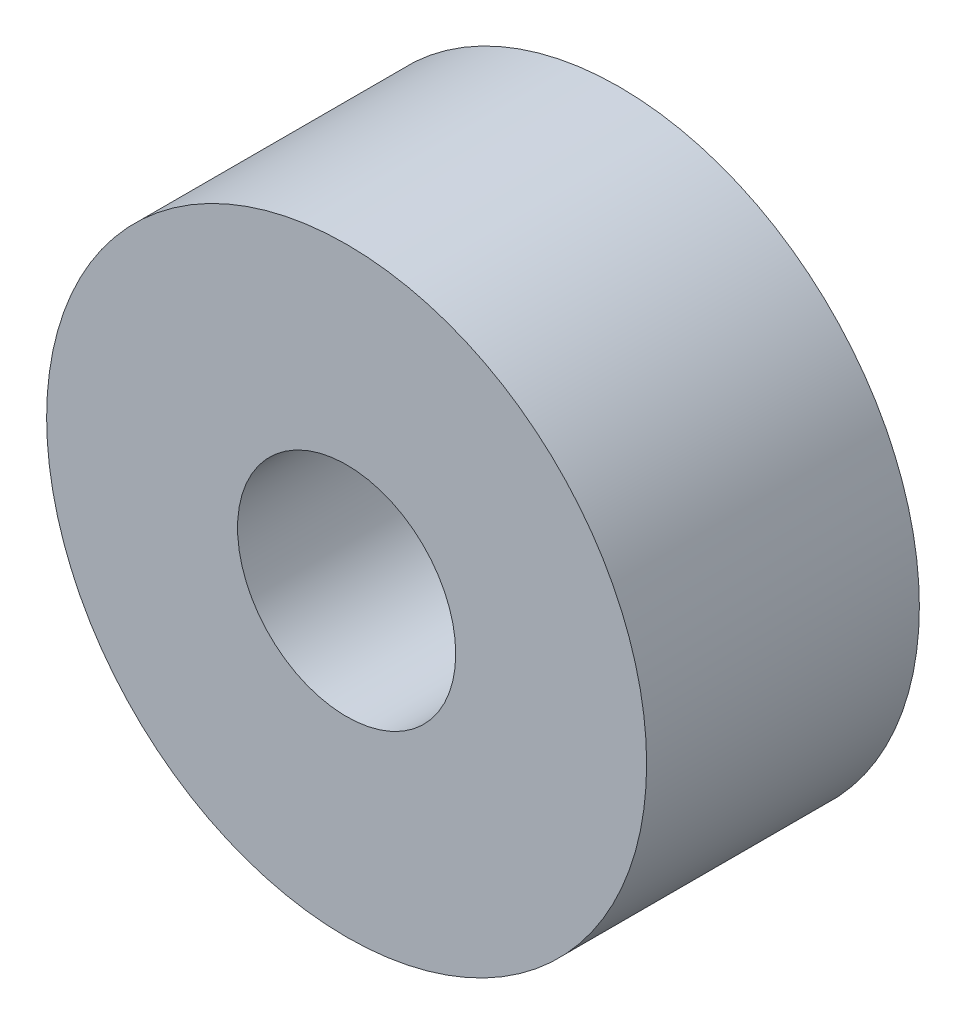
from build123d import *

# Parameters (mm, degrees)
SKETCH_1_R      = 11
SKETCH_1_R_2    = 4
EXTRUDE_1_DEPTH = 10


with BuildPart() as part:
    # Эскиз1 → Бобышка-Вытянуть1 (new body)
    with BuildSketch(Plane.XY):
        Circle(SKETCH_1_R)
        Circle(SKETCH_1_R_2, mode=Mode.SUBTRACT)
    extrude(amount=EXTRUDE_1_DEPTH)


solid = part.part
